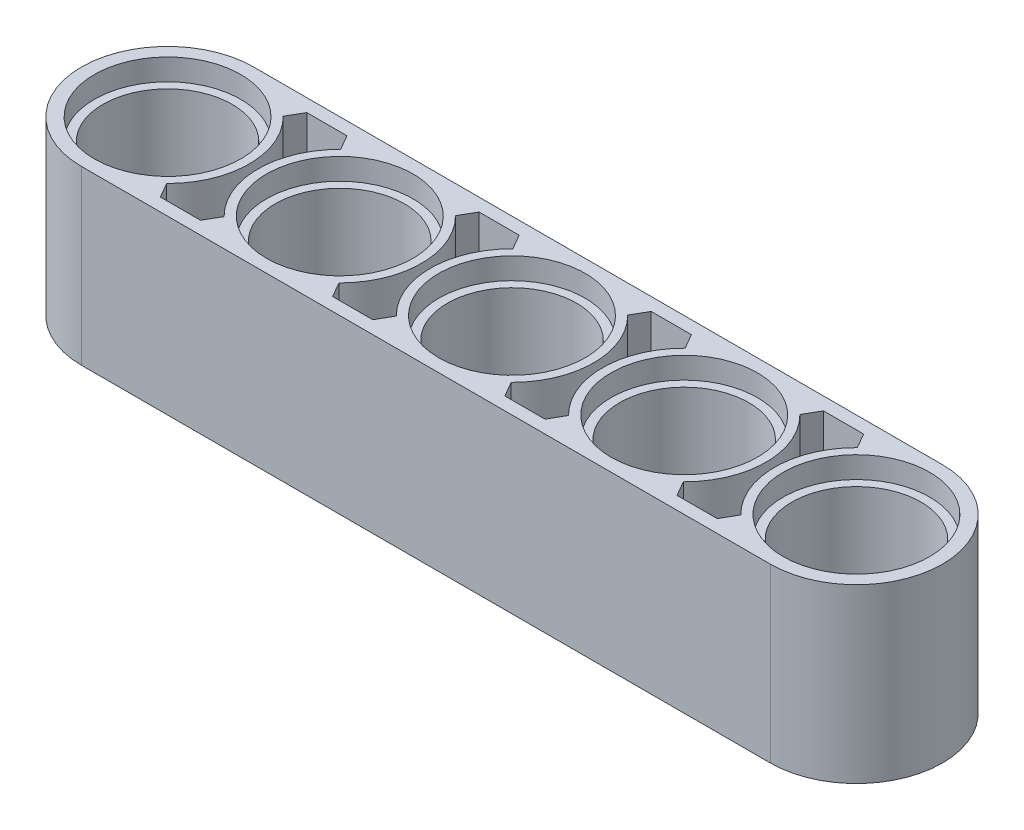
from build123d import *

# Parameters (mm, degrees)
SKETCH1_R            = 3
BOSS_EXTRUDE1_DEPTH  = 8
CUT_EXTRUDE1_START   = -1
SKETCH2_R            = 3.4
SKETCH2_R_2          = 3
CUT_EXTRUDE1_DEPTH   = 1
LPATTERN1_COUNT      = 5
LPATTERN1_PITCH      = 8
LPATTERN1_COUNT_DIR2 = 2
LPATTERN1_PITCH_DIR2 = 7
CUT_EXTRUDE2_DEPTH   = 3
LPATTERN2_COUNT      = 4
LPATTERN2_PITCH      = 8
LPATTERN2_COUNT_DIR2 = 2
LPATTERN2_PITCH_DIR2 = 5


with BuildPart() as part:
    # Sketch1 → Boss-Extrude1 (new body)
    with BuildSketch(Plane(origin=(0, 0, 0), x_dir=(1, 0, 0), z_dir=(0, 1, 0))):
        with BuildLine():
            Line((0, 4), (32, 4))
            ThreePointArc((32, 4), (36, 0), (32, -4))
            Line((32, -4), (0, -4))
            ThreePointArc((0, -4), (-4, 0), (0, 4))
        make_face()
        with Locations(Location((8, 0, 0), (0, 0, 270))):
            Circle(SKETCH1_R, mode=Mode.SUBTRACT)
        with Locations(Location((16, 0, 0), (0, 0, 270))):
            Circle(SKETCH1_R, mode=Mode.SUBTRACT)
        with Locations(Location((0, 0, 0), (0, 0, 270))):
            Circle(SKETCH1_R, mode=Mode.SUBTRACT)
        with Locations(Location((24, 0, 0), (0, 0, 270))):
            Circle(SKETCH1_R, mode=Mode.SUBTRACT)
        with Locations(Location((32, 0, 0), (0, 0, 270))):
            Circle(SKETCH1_R, mode=Mode.SUBTRACT)
    extrude(amount=BOSS_EXTRUDE1_DEPTH)

    # Sketch2 → Cut-Extrude1 (cut)
    with BuildSketch(Plane(origin=(0, 8, 0), x_dir=(1, 0, 0), z_dir=(0, 1, 0)).offset(CUT_EXTRUDE1_START)):
        with Locations(Location((0, 0, 0), (0, 0, 270))):
            Circle(SKETCH2_R)
        with Locations(Location((0, 0, 0), (0, 0, 270))):
            Circle(SKETCH2_R_2, mode=Mode.SUBTRACT)
    cut_extrude1 = extrude(amount=CUT_EXTRUDE1_DEPTH, mode=Mode.SUBTRACT)

    # LPattern1: Cut-Extrude1 5 × 2
    with Locations(*[(i * LPATTERN1_PITCH, -j * LPATTERN1_PITCH_DIR2, 0) for i in range(LPATTERN1_COUNT) for j in range(LPATTERN1_COUNT_DIR2) if (i, j) != (0, 0)]):
        add(cut_extrude1, mode=Mode.SUBTRACT)

    # Sketch3 → Cut-Extrude2 (cut)
    with BuildSketch(Plane(origin=(0, 8, 0), x_dir=(1, 0, 0), z_dir=(0, 1, 0))):
        with BuildLine():
            Line((3.066679245, -3.4), (4.933320755, -3.4))
            Line((4.933320755, -3.4), (5.333320755, -2.707179677))
            ThreePointArc((5.333320755, -2.707179677), (4.2, 0), (5.333320755, 2.707179677))
            Line((5.333320755, 2.707179677), (4.933320755, 3.4))
            Line((4.933320755, 3.4), (3.066679245, 3.4))
            Line((3.066679245, 3.4), (2.666679245, 2.707179677))
            ThreePointArc((2.666679245, 2.707179677), (3.8, 0), (2.666679245, -2.707179677))
            Line((2.666679245, -2.707179677), (3.066679245, -3.4))
        make_face()
    cut_extrude2 = extrude(amount=-CUT_EXTRUDE2_DEPTH, mode=Mode.SUBTRACT)

    # LPattern2: Cut-Extrude2 4 × 2
    with Locations(*[(i * LPATTERN2_PITCH, -j * LPATTERN2_PITCH_DIR2, 0) for i in range(LPATTERN2_COUNT) for j in range(LPATTERN2_COUNT_DIR2) if (i, j) != (0, 0)]):
        add(cut_extrude2, mode=Mode.SUBTRACT)


solid = part.part
